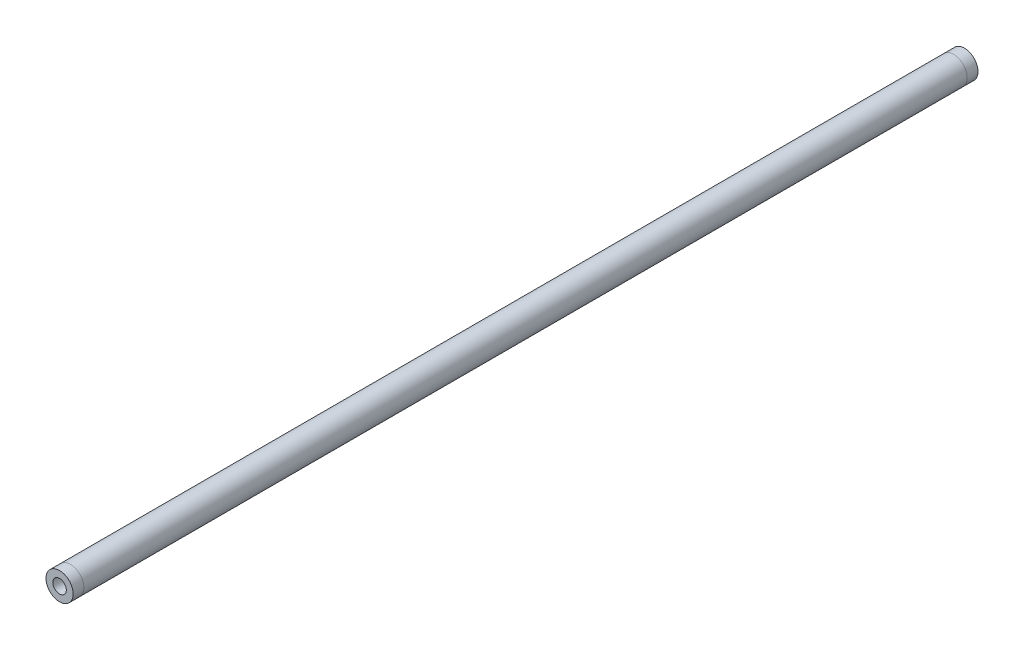
from build123d import *

# Parameters (mm, degrees)
SKETCH1_R                 = 8.001
SKETCH1_R_2               = 6.477
SKETCH1_R_3               = 3.96875
THREADED_INSERT_1_1_DEPTH = 6.35
THREADED_START            = -6.35
SKETCH1_3_R               = 6.477
SKETCH1_3_R_2             = 3.96875
THREADED_INSERT_1_2_DEPTH = 9.525
TUBE_START                = -6.35
SKETCH1_4_R               = 8.001
SKETCH1_4_R_2             = 6.477
TUBE_EXTRUDE_DEPTH        = 520.336266
THREADED_START_2          = -526.686266
SKETCH1_6_R               = 6.477
SKETCH1_6_R_2             = 3.96875
THREADED_INSERT_2_1_DEPTH = 9.525
SKETCH1_9_R               = 8.001
SKETCH1_9_R_2             = 6.477
SKETCH1_9_R_3             = 3.96875
THREADED_INSERT_2_2_DEPTH = 6.35


with BuildPart() as part:
    # Sketch1 → Threaded insert 1-1 (new body)
    # profile 1 of 2: a face of its own
    with BuildSketch(Plane.XY):
        Circle(SKETCH1_R)
        Circle(SKETCH1_R_2, mode=Mode.SUBTRACT)
    # profile 2 of 2: a face of its own
    with BuildSketch(Plane.XY):
        Circle(SKETCH1_R_2)
        Circle(SKETCH1_R_3, mode=Mode.SUBTRACT)
    extrude(amount=-THREADED_INSERT_1_1_DEPTH)

    # Sketch1<3> → Threaded insert 1-2 (add)
    with BuildSketch(Plane.XY.offset(THREADED_START)):
        Circle(SKETCH1_3_R)
        Circle(SKETCH1_3_R_2, mode=Mode.SUBTRACT)
    extrude(amount=-THREADED_INSERT_1_2_DEPTH)


with BuildPart() as body_2:
    # Sketch1<4> → Tube extrude (new body)
    with BuildSketch(Plane.XY.offset(TUBE_START)):
        Circle(SKETCH1_4_R)
        Circle(SKETCH1_4_R_2, mode=Mode.SUBTRACT)
    extrude(amount=-TUBE_EXTRUDE_DEPTH)


with BuildPart() as body_3:
    # Sketch1<6> → Threaded insert 2-1 (new body)
    with BuildSketch(Plane.XY.offset(THREADED_START_2)):
        Circle(SKETCH1_6_R)
        Circle(SKETCH1_6_R_2, mode=Mode.SUBTRACT)
    extrude(amount=THREADED_INSERT_2_1_DEPTH)


with BuildPart() as body_4:
    # Sketch1<9> → Threaded insert 2-2 (new body)
    # profile 1 of 2: a face of its own
    with BuildSketch(Plane.XY.offset(THREADED_START_2)):
        Circle(SKETCH1_9_R)
        Circle(SKETCH1_9_R_2, mode=Mode.SUBTRACT)
    # profile 2 of 2: a face of its own
    with BuildSketch(Plane.XY.offset(THREADED_START_2)):
        Circle(SKETCH1_9_R_2)
        Circle(SKETCH1_9_R_3, mode=Mode.SUBTRACT)
    extrude(amount=-THREADED_INSERT_2_2_DEPTH)

    # Combine1: union body 3
    add(body_3.part)


solid = Compound([part.part, body_2.part, body_4.part])
